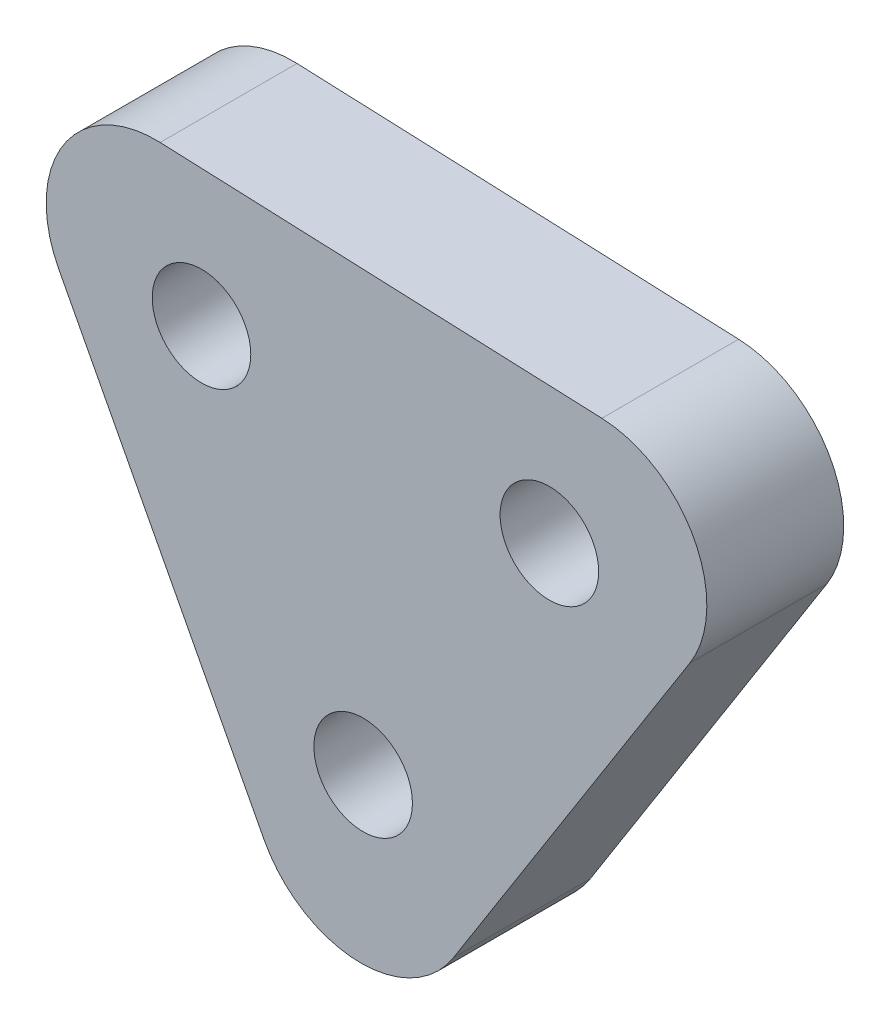
from build123d import *

# Parameters (mm, degrees)
ESQUISSE1_R        = 1.8
BOSS_EXTRU_1_DEPTH = 5
CONG_1_R           = 4


with BuildPart() as part:
    # Esquisse1 → Boss.-Extru.1 (new body)
    with BuildSketch(Plane.XY):
        Polygon((-32.799356044, 12.280796054), (-2.817383551, 11.058367683), (-18.866700046, -14.287626874), align=None)
        with Locations((-18.459525699, -4.301037602)):
            Circle(ESQUISSE1_R, mode=Mode.SUBTRACT)
        with Locations((-24.365403682, 6.945977976)):
            Circle(ESQUISSE1_R, mode=Mode.SUBTRACT)
        with Locations((-11.657643474, 6.427855741)):
            Circle(ESQUISSE1_R, mode=Mode.SUBTRACT)
    extrude(amount=BOSS_EXTRU_1_DEPTH)

    # Congé1
    cong_1_edges = [part.edges().sort_by_distance(p)[0] for p in [
        (-32.799356044, 12.280796054, 2.5),
        (-2.817383551, 11.058367683, 2.5),
        (-18.866700046, -14.287626874, 2.5),
    ]]
    fillet(cong_1_edges, radius=CONG_1_R)


solid = part.part
